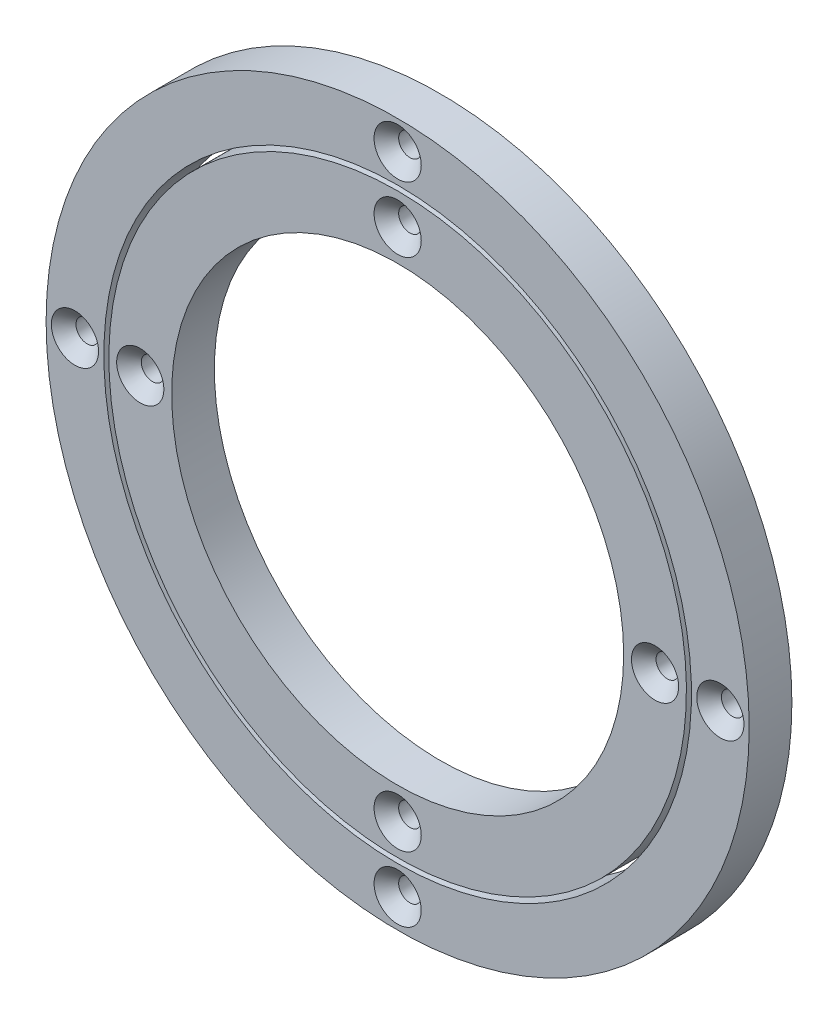
from build123d import *

# Parameters (mm, degrees)
SKETCH2_R                                    = 70
SKETCH2_R_2                                  = 45
BOSS_EXTRUDE1_DEPTH                          = 8.5
SKETCH2_3_R                                  = 58.5
SKETCH2_3_R_2                                = 57.5
CUT_EXTRUDE_THIN2_DEPTH                      = 100.359196857
CSK_FOR_M4_COUNTERSUNK_FLAT_HEAD_SCR_2_COUNT = 2
CSK_FOR_M4_COUNTERSUNK_FLAT_HEAD_SCR_2_PITCH = 90.863221382
CSK_FOR_M4_COUNTERSUNK_FLAT_HEAD_SCR_3_COUNT = 2
CSK_FOR_M4_COUNTERSUNK_FLAT_HEAD_SCR_3_PITCH = 128.5
CSK_FOR_M4_COUNTERSUNK_FLAT_HEAD_SCR_4_COUNT = 2
CSK_FOR_M4_COUNTERSUNK_FLAT_HEAD_SCR_4_PITCH = 90.863221382
CSK_FOR_M4_COUNTERSUNK_FLAT_HEAD_SCR_5_COUNT = 2
CSK_FOR_M4_COUNTERSUNK_FLAT_HEAD_SCR_5_PITCH = 13
CSK_FOR_M4_COUNTERSUNK_FLAT_HEAD_SCR_6_COUNT = 2
CSK_FOR_M4_COUNTERSUNK_FLAT_HEAD_SCR_6_PITCH = 82.18652566
CSK_FOR_M4_COUNTERSUNK_FLAT_HEAD_SCR_7_COUNT = 2
CSK_FOR_M4_COUNTERSUNK_FLAT_HEAD_SCR_7_PITCH = 115.5
CSK_FOR_M4_COUNTERSUNK_FLAT_HEAD_SCR_8_COUNT = 2
CSK_FOR_M4_COUNTERSUNK_FLAT_HEAD_SCR_8_PITCH = 82.18652566


with BuildPart() as part:
    # Sketch2 → Boss-Extrude1 (new body)
    with BuildSketch(Plane(origin=(0, 0, 0), x_dir=(0, 1, 0), z_dir=(0, 0, 1))):
        Circle(SKETCH2_R)
        Circle(SKETCH2_R_2, mode=Mode.SUBTRACT)
    extrude(amount=BOSS_EXTRUDE1_DEPTH)

    # Sketch2<3> → Cut-Extrude-Thin2 (cut, through all)
    with BuildSketch(Plane(origin=(0, 0, 0), x_dir=(0, 1, 0), z_dir=(0, 0, 1))):
        Circle(SKETCH2_3_R)
        Circle(SKETCH2_3_R_2, mode=Mode.SUBTRACT)
    extrude(amount=CUT_EXTRUDE_THIN2_DEPTH, mode=Mode.SUBTRACT)


with BuildPart() as cut_extrude_thin2_piece_1:
    # of the separate pieces the step leaves, piece 1, a body of its own (cut_extrude_thin2_pieces)
    add(part.part.solids().sort_by_distance((0, 70, 0))[0])

    # Sketch4 → CSK for M4 Countersunk Flat Head Screw1 (revolve, cut)
    with BuildSketch(Plane(origin=(64.25, 0, 8.5), x_dir=(0, -1, 0), z_dir=(1, 0, 0))):
        Polygon((0, 0), (0, 8.5), (2.25, 8.5), (2.25, 2.45), (4.7, 0), align=None)
    csk_for_m4_countersunk_flat_head_screw1 = revolve(axis=Axis((64.25, 0, 14.85), (0, 0, -1)), mode=Mode.SUBTRACT)

    # CSK for M4 Countersunk Flat Head Scr 2: CSK for M4 Countersunk Flat Head Screw1 ×2
    with Locations(*[Vector(-0.7071067811865476, -0.7071067811865476, 0) * (i * CSK_FOR_M4_COUNTERSUNK_FLAT_HEAD_SCR_2_PITCH) for i in range(1, CSK_FOR_M4_COUNTERSUNK_FLAT_HEAD_SCR_2_COUNT)]):
        add(csk_for_m4_countersunk_flat_head_screw1, mode=Mode.SUBTRACT)

    # CSK for M4 Countersunk Flat Head Scr 3: CSK for M4 Countersunk Flat Head Screw1 ×2
    with Locations(*[(-i * CSK_FOR_M4_COUNTERSUNK_FLAT_HEAD_SCR_3_PITCH, 0, 0) for i in range(1, CSK_FOR_M4_COUNTERSUNK_FLAT_HEAD_SCR_3_COUNT)]):
        add(csk_for_m4_countersunk_flat_head_screw1, mode=Mode.SUBTRACT)

    # CSK for M4 Countersunk Flat Head Scr 4: CSK for M4 Countersunk Flat Head Screw1 ×2
    with Locations(*[Vector(-0.7071067811865476, 0.7071067811865476, 0) * (i * CSK_FOR_M4_COUNTERSUNK_FLAT_HEAD_SCR_4_PITCH) for i in range(1, CSK_FOR_M4_COUNTERSUNK_FLAT_HEAD_SCR_4_COUNT)]):
        add(csk_for_m4_countersunk_flat_head_screw1, mode=Mode.SUBTRACT)


with BuildPart() as cut_extrude_thin2_piece_2:
    # of the separate pieces the step leaves, piece 2, a body of its own (cut_extrude_thin2_pieces)
    add(part.part.solids().sort_by_distance((0, 57.5, 0))[0])

    # CSK for M4 Countersunk Flat Head Scr 5: CSK for M4 Countersunk Flat Head Screw1 ×2
    with Locations(*[(-i * CSK_FOR_M4_COUNTERSUNK_FLAT_HEAD_SCR_5_PITCH, 0, 0) for i in range(1, CSK_FOR_M4_COUNTERSUNK_FLAT_HEAD_SCR_5_COUNT)]):
        add(csk_for_m4_countersunk_flat_head_screw1, mode=Mode.SUBTRACT)

    # CSK for M4 Countersunk Flat Head Scr 6: CSK for M4 Countersunk Flat Head Screw1 ×2
    with Locations(*[Vector(-0.7817583172464547, -0.6235815371032014, 0) * (i * CSK_FOR_M4_COUNTERSUNK_FLAT_HEAD_SCR_6_PITCH) for i in range(1, CSK_FOR_M4_COUNTERSUNK_FLAT_HEAD_SCR_6_COUNT)]):
        add(csk_for_m4_countersunk_flat_head_screw1, mode=Mode.SUBTRACT)

    # CSK for M4 Countersunk Flat Head Scr 7: CSK for M4 Countersunk Flat Head Screw1 ×2
    with Locations(*[(-i * CSK_FOR_M4_COUNTERSUNK_FLAT_HEAD_SCR_7_PITCH, 0, 0) for i in range(1, CSK_FOR_M4_COUNTERSUNK_FLAT_HEAD_SCR_7_COUNT)]):
        add(csk_for_m4_countersunk_flat_head_screw1, mode=Mode.SUBTRACT)

    # CSK for M4 Countersunk Flat Head Scr 8: CSK for M4 Countersunk Flat Head Screw1 ×2
    with Locations(*[Vector(-0.7817583172464514, 0.6235815371032057, 0) * (i * CSK_FOR_M4_COUNTERSUNK_FLAT_HEAD_SCR_8_PITCH) for i in range(1, CSK_FOR_M4_COUNTERSUNK_FLAT_HEAD_SCR_8_COUNT)]):
        add(csk_for_m4_countersunk_flat_head_screw1, mode=Mode.SUBTRACT)


solid = Compound([cut_extrude_thin2_piece_1.part, cut_extrude_thin2_piece_2.part])
